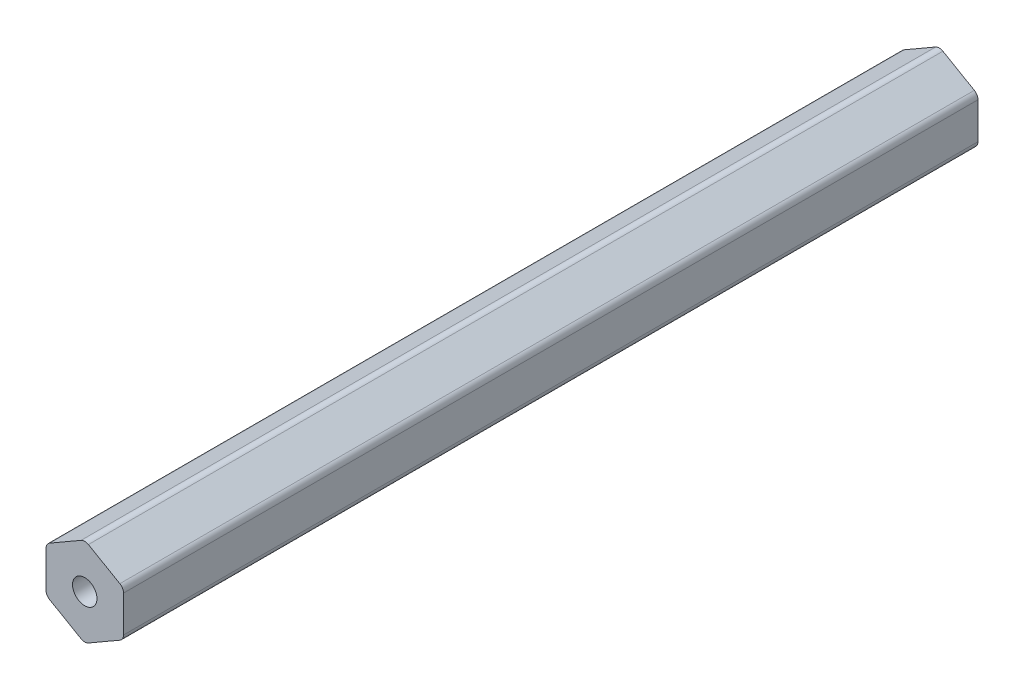
from build123d import *

# Parameters (mm, degrees)
SKETCH2_R           = 2
BOSS_EXTRUDE1_DEPTH = 140


with BuildPart() as part:
    # Sketch2 → Boss-Extrude1 (new body)
    with BuildSketch(Plane.XY):
        with BuildLine():
            Line((0.6, -6.985938257), (5.75, -4.012584371))
            ThreePointArc((5.75, -4.012584371), (6.189230485, -3.573353886), (6.35, -2.973353886))
            Line((6.35, -2.973353886), (6.35, 2.973353886))
            ThreePointArc((6.35, 2.973353886), (6.189230485, 3.573353886), (5.75, 4.012584371))
            Line((5.75, 4.012584371), (0.6, 6.985938257))
            ThreePointArc((0.6, 6.985938257), (0, 7.146707773), (-0.6, 6.985938257))
            Line((-0.6, 6.985938257), (-5.75, 4.012584371))
            ThreePointArc((-5.75, 4.012584371), (-6.189230485, 3.573353886), (-6.35, 2.973353886))
            Line((-6.35, 2.973353886), (-6.35, -2.973353886))
            ThreePointArc((-6.35, -2.973353886), (-6.189230485, -3.573353886), (-5.75, -4.012584371))
            Line((-5.75, -4.012584371), (-0.6, -6.985938257))
            ThreePointArc((-0.6, -6.985938257), (0, -7.146707773), (0.6, -6.985938257))
        make_face()
        Circle(SKETCH2_R, mode=Mode.SUBTRACT)
    extrude(amount=BOSS_EXTRUDE1_DEPTH)


solid = part.part
